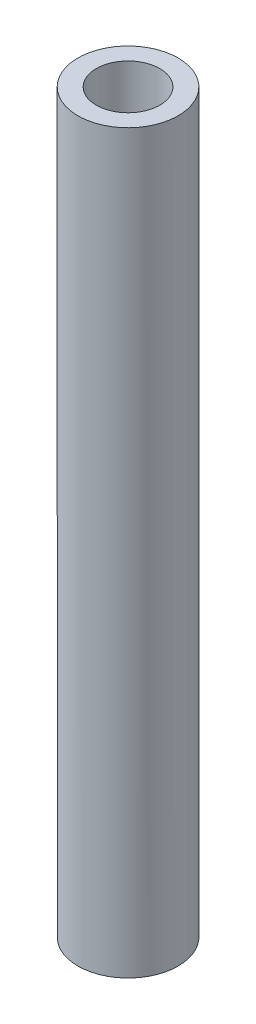
from build123d import *

# Parameters (mm, degrees)
SKETCH1_R               = 4.7625
SKETCH1_R_2             = 3.018976491
BOSS_EXTRUDE1_DEPTH     = 65
CUT_EXTRUDE2_DEPTH      = 66.348013072
CUT_EXTRUDE2_DEPTH_BACK = 66.348013072
SKETCH5_W               = 36.473052953
SKETCH5_H               = 81.397778837


with BuildPart() as part:
    # Sketch1 → Boss-Extrude1 (new, symmetric)
    with BuildSketch(Plane(origin=(0, 0, 0), x_dir=(1, 0, 0), z_dir=(0, 1, 0))):
        with Locations(Location((0, 0, 0), (0, 0, 270))):
            Circle(SKETCH1_R)
        with Locations(Location((0, 0, 0), (0, 0, 270))):
            Circle(SKETCH1_R_2, mode=Mode.SUBTRACT)
    extrude(amount=BOSS_EXTRUDE1_DEPTH, both=True)

    # Sketch5 → Cut-Extrude2 (cut, two sides: drawn at the far end of the back side and taken through both)
    with BuildSketch(Plane(origin=(0, 0, 0), x_dir=(0, 0, -1), z_dir=(1, 0, 0)).offset(-CUT_EXTRUDE2_DEPTH_BACK)):
        with Locations((-2.67750977, 45.698889419)):
            Rectangle(SKETCH5_W, SKETCH5_H)
    extrude(amount=CUT_EXTRUDE2_DEPTH + CUT_EXTRUDE2_DEPTH_BACK, mode=Mode.SUBTRACT)


solid = part.part
